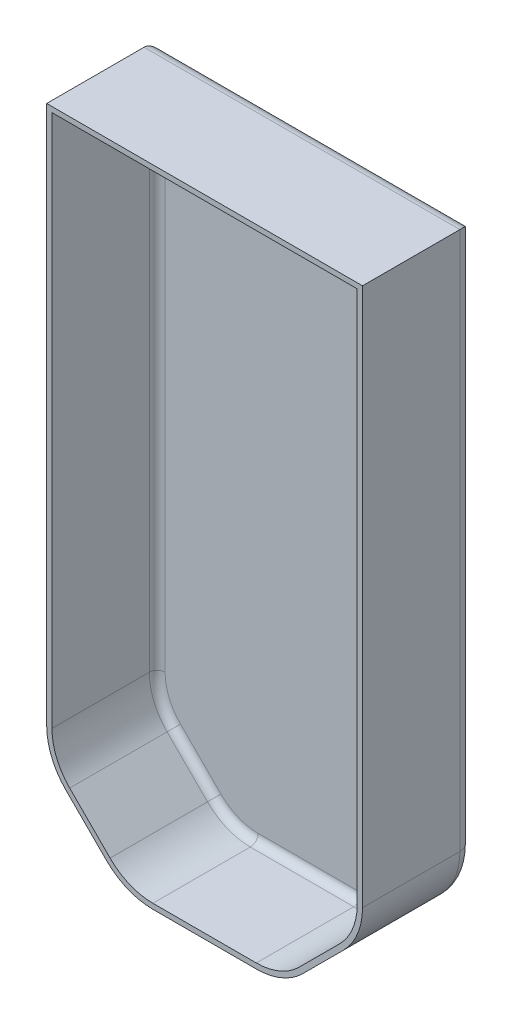
from build123d import *

# Parameters (mm, degrees)
SKETCH1_W           = 120
SKETCH1_H           = 245
BOSS_EXTRUDE1_DEPTH = 42
CHAMFER1_SIZE       = 30
FILLET3_R           = 25
FILLET1_R           = 5
SHELL1_T            = -2


with BuildPart() as part:
    # Sketch1 → Boss-Extrude1 (new body)
    with BuildSketch(Plane.XY):
        with Locations((0, 72.5)):
            Rectangle(SKETCH1_W, SKETCH1_H)
    extrude(amount=BOSS_EXTRUDE1_DEPTH)

    # Chamfer1
    chamfer1_edges = [part.edges().sort_by_distance(p)[0] for p in [
        (-60, -50, 21),
        (60, -50, 21),
    ]]
    chamfer(chamfer1_edges, length=CHAMFER1_SIZE)

    # Fillet3
    fillet3_edges = [part.edges().sort_by_distance(p)[0] for p in [
        (-60, -20, 21),
        (-30, -50, 21),
        (30, -50, 21),
        (60, -20, 21),
    ]]
    fillet(fillet3_edges, radius=FILLET3_R)

    # Fillet1
    fillet1_edges = [part.edges().sort_by_distance(p)[0] for p in [
        (0, -50, 0),
        (60, 92.67766953, 0),
        (0, 195, 0),
        (-60, 92.67766953, 0),
        (-29.21174675, -48.096988313, 0),
        (29.21174675, -48.096988313, 0),
        (45, -35, 0),
        (58.096988313, -19.21174675, 0),
        (-58.096988313, -19.21174675, 0),
        (-45, -35, 0),
    ]]
    fillet(fillet1_edges, radius=FILLET1_R)

    # Shell1
    shell1_openings = [part.faces().sort_by_distance(p)[0] for p in [
        (0, 76.260599265, 42),
    ]]
    offset(amount=SHELL1_T, openings=shell1_openings)


solid = part.part
